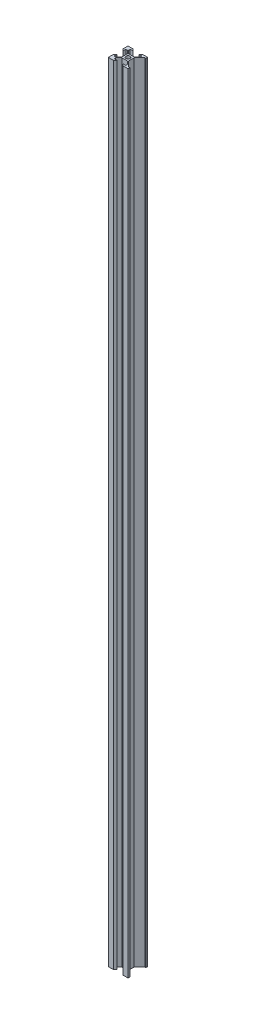
from build123d import *

# Parameters (mm, degrees)
EXTRUDE_1_DEPTH          = 800
CUT_EXTRUDE_1_DEPTH      = 802.623352953
CUT_EXTRUDE_1_DEPTH_BACK = 802.623352953
SKETCH_2_W               = 44.352947912
SKETCH_2_H               = 26.447385174


with BuildPart() as part:
    # 草图1 → 凸台-拉伸1 (new body)
    with BuildSketch(Plane(origin=(0, 0, 0), x_dir=(1, 0, 0), z_dir=(0, 1, 0))):
        with BuildLine():
            Line((-3.476396103, 2.84), (-3.476396103, 0))
            Line((-3.476396103, 0), (-2.1, 0))
            ThreePointArc((-2.1, 0), (-1.48492424, 1.48492424), (0, 2.1))
            Line((0, 2.1), (0, 3.476396103))
            Line((0, 3.476396103), (-2.84, 3.476396103))
            Line((-2.84, 3.476396103), (-5.923603897, 6.56))
            Line((-5.923603897, 6.56), (-5.923603897, 8.2))
            Line((-5.923603897, 8.2), (-3.1, 8.2))
            Line((-3.1, 8.2), (-4.9, 10))
            Line((-4.9, 10), (-10, 10))
            Line((-10, 10), (-10, 4.9))
            Line((-10, 4.9), (-8.2, 3.1))
            Line((-8.2, 3.1), (-8.2, 5.923603897))
            Line((-8.2, 5.923603897), (-6.56, 5.923603897))
            Line((-6.56, 5.923603897), (-3.476396103, 2.84))
        make_face()
        with BuildLine():
            Line((-2.1, 0), (-3.476396103, 0))
            Line((-3.476396103, 0), (-3.476396103, -2.84))
            Line((-3.476396103, -2.84), (-6.56, -5.923603897))
            Line((-6.56, -5.923603897), (-8.2, -5.923603897))
            Line((-8.2, -5.923603897), (-8.2, -3.1))
            Line((-8.2, -3.1), (-10, -4.9))
            Line((-10, -4.9), (-10, -10))
            Line((-10, -10), (-4.9, -10))
            Line((-4.9, -10), (-3.1, -8.2))
            Line((-3.1, -8.2), (-5.923603897, -8.2))
            Line((-5.923603897, -8.2), (-5.923603897, -6.56))
            Line((-5.923603897, -6.56), (-2.84, -3.476396103))
            Line((-2.84, -3.476396103), (0, -3.476396103))
            Line((0, -3.476396103), (0, -2.1))
            ThreePointArc((0, -2.1), (-1.48492424, -1.48492424), (-2.1, 0))
        make_face()
        with BuildLine():
            ThreePointArc((2.1, 0), (1.48492424, -1.48492424), (0, -2.1))
            Line((0, -2.1), (0, -3.476396103))
            Line((0, -3.476396103), (2.84, -3.476396103))
            Line((2.84, -3.476396103), (5.923603897, -6.56))
            Line((5.923603897, -6.56), (5.923603897, -8.2))
            Line((5.923603897, -8.2), (3.1, -8.2))
            Line((3.1, -8.2), (4.9, -10))
            Line((4.9, -10), (15.1, -10))
            Line((15.1, -10), (16.9, -8.2))
            Line((16.9, -8.2), (14.076396103, -8.2))
            Line((14.076396103, -8.2), (14.076396103, -6.56))
            Line((14.076396103, -6.56), (17.16, -3.476396103))
            Line((17.16, -3.476396103), (20, -3.476396103))
            Line((20, -3.476396103), (20, -2.1))
            ThreePointArc((20, -2.1), (18.51507576, -1.48492424), (17.9, 0))
            Line((17.9, 0), (16.523603897, 0))
            Line((16.523603897, 0), (16.523603897, -2.84))
            Line((16.523603897, -2.84), (13.44, -5.923603897))
            Line((13.44, -5.923603897), (11.163603897, -8.2))
            Line((11.163603897, -8.2), (8.836396103, -8.2))
            Line((8.836396103, -8.2), (6.56, -5.923603897))
            Line((6.56, -5.923603897), (3.476396103, -2.84))
            Line((3.476396103, -2.84), (3.476396103, 0))
            Line((3.476396103, 0), (2.1, 0))
        make_face()
        with BuildLine():
            Line((0, 3.476396103), (0, 2.1))
            ThreePointArc((0, 2.1), (1.48492424, 1.48492424), (2.1, 0))
            Line((2.1, 0), (3.476396103, 0))
            Line((3.476396103, 0), (3.476396103, 2.84))
            Line((3.476396103, 2.84), (6.56, 5.923603897))
            Line((6.56, 5.923603897), (8.836396103, 8.2))
            Line((8.836396103, 8.2), (11.163603897, 8.2))
            Line((11.163603897, 8.2), (13.44, 5.923603897))
            Line((13.44, 5.923603897), (16.523603897, 2.84))
            Line((16.523603897, 2.84), (16.523603897, 0))
            Line((16.523603897, 0), (17.9, 0))
            ThreePointArc((17.9, 0), (18.51507576, 1.48492424), (20, 2.1))
            Line((20, 2.1), (20, 3.476396103))
            Line((20, 3.476396103), (17.16, 3.476396103))
            Line((17.16, 3.476396103), (14.076396103, 6.56))
            Line((14.076396103, 6.56), (14.076396103, 8.2))
            Line((14.076396103, 8.2), (16.9, 8.2))
            Line((16.9, 8.2), (15.1, 10))
            Line((15.1, 10), (4.9, 10))
            Line((4.9, 10), (3.1, 8.2))
            Line((3.1, 8.2), (5.923603897, 8.2))
            Line((5.923603897, 8.2), (5.923603897, 6.56))
            Line((5.923603897, 6.56), (2.84, 3.476396103))
            Line((2.84, 3.476396103), (0, 3.476396103))
        make_face()
        with BuildLine():
            Line((20, 3.476396103), (20, 2.1))
            ThreePointArc((20, 2.1), (21.48492424, 1.48492424), (22.1, 0))
            Line((22.1, 0), (23.476396103, 0))
            Line((23.476396103, 0), (23.476396103, 2.84))
            Line((23.476396103, 2.84), (26.56, 5.923603897))
            Line((26.56, 5.923603897), (28.836396103, 8.2))
            Line((28.836396103, 8.2), (31.163603897, 8.2))
            Line((31.163603897, 8.2), (33.44, 5.923603897))
            Line((33.44, 5.923603897), (36.523603897, 2.84))
            Line((36.523603897, 2.84), (36.523603897, 0))
            Line((36.523603897, 0), (37.9, 0))
            ThreePointArc((37.9, 0), (40, 2.1), (42.1, 0))
            Line((42.1, 0), (43.476396103, 0))
            Line((43.476396103, 0), (43.476396103, 2.84))
            Line((43.476396103, 2.84), (46.56, 5.923603897))
            Line((46.56, 5.923603897), (48.2, 5.923603897))
            Line((48.2, 5.923603897), (48.2, 3.1))
            Line((48.2, 3.1), (50, 4.9))
            Line((50, 4.9), (50, 10))
            Line((50, 10), (44.9, 10))
            Line((44.9, 10), (43.1, 8.2))
            Line((43.1, 8.2), (45.923603897, 8.2))
            Line((45.923603897, 8.2), (45.923603897, 6.56))
            Line((45.923603897, 6.56), (42.84, 3.476396103))
            Line((42.84, 3.476396103), (37.16, 3.476396103))
            Line((37.16, 3.476396103), (34.076396103, 6.56))
            Line((34.076396103, 6.56), (34.076396103, 8.2))
            Line((34.076396103, 8.2), (36.9, 8.2))
            Line((36.9, 8.2), (35.1, 10))
            Line((35.1, 10), (24.9, 10))
            Line((24.9, 10), (23.1, 8.2))
            Line((23.1, 8.2), (25.923603897, 8.2))
            Line((25.923603897, 8.2), (25.923603897, 6.56))
            Line((25.923603897, 6.56), (22.84, 3.476396103))
            Line((22.84, 3.476396103), (20, 3.476396103))
        make_face()
        with BuildLine():
            ThreePointArc((22.1, 0), (21.48492424, -1.48492424), (20, -2.1))
            Line((20, -2.1), (20, -3.476396103))
            Line((20, -3.476396103), (22.84, -3.476396103))
            Line((22.84, -3.476396103), (25.923603897, -6.56))
            Line((25.923603897, -6.56), (25.923603897, -8.2))
            Line((25.923603897, -8.2), (23.1, -8.2))
            Line((23.1, -8.2), (24.9, -10))
            Line((24.9, -10), (35.1, -10))
            Line((35.1, -10), (36.9, -8.2))
            Line((36.9, -8.2), (34.076396103, -8.2))
            Line((34.076396103, -8.2), (34.076396103, -6.56))
            Line((34.076396103, -6.56), (37.16, -3.476396103))
            Line((37.16, -3.476396103), (42.84, -3.476396103))
            Line((42.84, -3.476396103), (45.923603897, -6.56))
            Line((45.923603897, -6.56), (45.923603897, -8.2))
            Line((45.923603897, -8.2), (43.1, -8.2))
            Line((43.1, -8.2), (44.9, -10))
            Line((44.9, -10), (50, -10))
            Line((50, -10), (50, -4.9))
            Line((50, -4.9), (48.2, -3.1))
            Line((48.2, -3.1), (48.2, -5.923603897))
            Line((48.2, -5.923603897), (46.56, -5.923603897))
            Line((46.56, -5.923603897), (43.476396103, -2.84))
            Line((43.476396103, -2.84), (43.476396103, 0))
            Line((43.476396103, 0), (42.1, 0))
            ThreePointArc((42.1, 0), (40, -2.1), (37.9, 0))
            Line((37.9, 0), (36.523603897, 0))
            Line((36.523603897, 0), (36.523603897, -2.84))
            Line((36.523603897, -2.84), (33.44, -5.923603897))
            Line((33.44, -5.923603897), (31.163603897, -8.2))
            Line((31.163603897, -8.2), (28.836396103, -8.2))
            Line((28.836396103, -8.2), (26.56, -5.923603897))
            Line((26.56, -5.923603897), (23.476396103, -2.84))
            Line((23.476396103, -2.84), (23.476396103, 0))
            Line((23.476396103, 0), (22.1, 0))
        make_face()
    extrude(amount=EXTRUDE_1_DEPTH)

    # 草图2 → 切除-拉伸1 (cut, two sides: drawn at the far end of the back side and taken through both)
    with BuildSketch(Plane(origin=(0, 800, 0), x_dir=(1, 0, 0), z_dir=(0, 1, 0)).offset(-CUT_EXTRUDE_1_DEPTH_BACK)):
        with Locations((32.176473956, -3.223692587)):
            Rectangle(SKETCH_2_W, SKETCH_2_H)
    extrude(amount=CUT_EXTRUDE_1_DEPTH + CUT_EXTRUDE_1_DEPTH_BACK, mode=Mode.SUBTRACT)


solid = part.part
